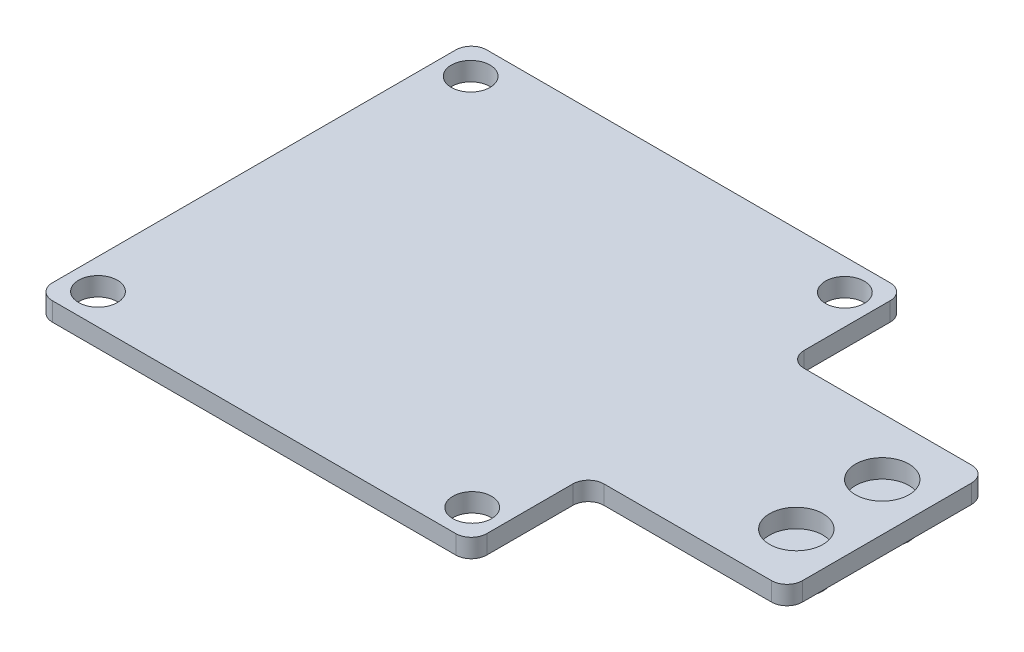
from build123d import *

# Parameters (mm, degrees)
SKETCH1_R             = 1.5875
SKETCH1_R_2           = 2.1844
BOSS_EXTRUDE2_DEPTH   = 1.524
SKETCH3_R             = 2.1844
BOSS_EXTRUDE4_DEPTH   = 1.778
BOSS_EXTRUDE4_2_DEPTH = 1.778


with BuildPart() as part:
    # Sketch1 → Boss-Extrude2 (new body)
    with BuildSketch(Plane(origin=(0, 0, 0), x_dir=(1, 0, 0), z_dir=(0, 1, 0))):
        with BuildLine():
            Line((-50.746188486, 35.427401309), (-17.726188486, 35.427401309))
            ThreePointArc((-17.726188486, 35.427401309), (-16.828162874, 35.055426921), (-16.456188486, 34.157401309))
            Line((-16.456188486, 34.157401309), (-16.456188486, 27.108901309))
            ThreePointArc((-16.456188486, 27.108901309), (-16.084214098, 26.210875697), (-15.186188486, 25.838901309))
            Line((-15.186188486, 25.838901309), (-1.470188486, 25.838901309))
            ThreePointArc((-1.470188486, 25.838901309), (-0.572162874, 25.466926921), (-0.200188486, 24.568901309))
            Line((-0.200188486, 24.568901309), (-0.200188486, 10.725901309))
            ThreePointArc((-0.200188486, 10.725901309), (-0.572162874, 9.827875697), (-1.470188486, 9.455901309))
            Line((-1.470188486, 9.455901309), (-15.186188486, 9.455901309))
            ThreePointArc((-15.186188486, 9.455901309), (-16.084214098, 9.083926921), (-16.456188486, 8.185901309))
            Line((-16.456188486, 8.185901309), (-16.456188486, 1.137401309))
            ThreePointArc((-16.456188486, 1.137401309), (-16.828162874, 0.239375697), (-17.726188486, -0.132598691))
            Line((-17.726188486, -0.132598691), (-50.746188486, -0.132598691))
            ThreePointArc((-50.746188486, -0.132598691), (-51.644214098, 0.239375697), (-52.016188486, 1.137401309))
            Line((-52.016188486, 1.137401309), (-52.016188486, 34.157401309))
            ThreePointArc((-52.016188486, 34.157401309), (-51.644214098, 35.055426921), (-50.746188486, 35.427401309))
        make_face()
        with Locations(Location((-49.539688486, 32.900101309, 0), (0, 0, 90))):
            Circle(SKETCH1_R, mode=Mode.SUBTRACT)
        with Locations(Location((-18.907288486, 32.900101309, 0), (0, 0, 90))):
            Circle(SKETCH1_R, mode=Mode.SUBTRACT)
        with Locations(Location((-18.907288486, 2.394701309, 0), (0, 0, 90))):
            Circle(SKETCH1_R, mode=Mode.SUBTRACT)
        with Locations(Location((-49.539688486, 2.394701309, 0), (0, 0, 90))):
            Circle(SKETCH1_R, mode=Mode.SUBTRACT)
        with Locations(Location((-4.111788486, 21.165301309, 0), (0, 0, 90))):
            Circle(SKETCH1_R_2, mode=Mode.SUBTRACT)
        with Locations(Location((-4.111788486, 14.129501309, 0), (0, 0, 90))):
            Circle(SKETCH1_R_2, mode=Mode.SUBTRACT)
    extrude(amount=BOSS_EXTRUDE2_DEPTH)


with BuildPart() as body_2:
    # Sketch3 → Boss-Extrude4 (new body)
    with BuildSketch(Plane.XZ):
        with Locations(Location((-4.111788486, -14.129501309, 0), (0, 0, 270))):
            Circle(SKETCH3_R)
    extrude(amount=BOSS_EXTRUDE4_DEPTH)


with BuildPart() as body_3:
    # Sketch3 → Boss-Extrude4 2 (new body)
    with BuildSketch(Plane.XZ):
        with Locations(Location((-4.111788486, -21.165301309, 0), (0, 0, 270))):
            Circle(SKETCH3_R)
    extrude(amount=BOSS_EXTRUDE4_2_DEPTH)


solid = Compound([part.part, body_2.part, body_3.part])
